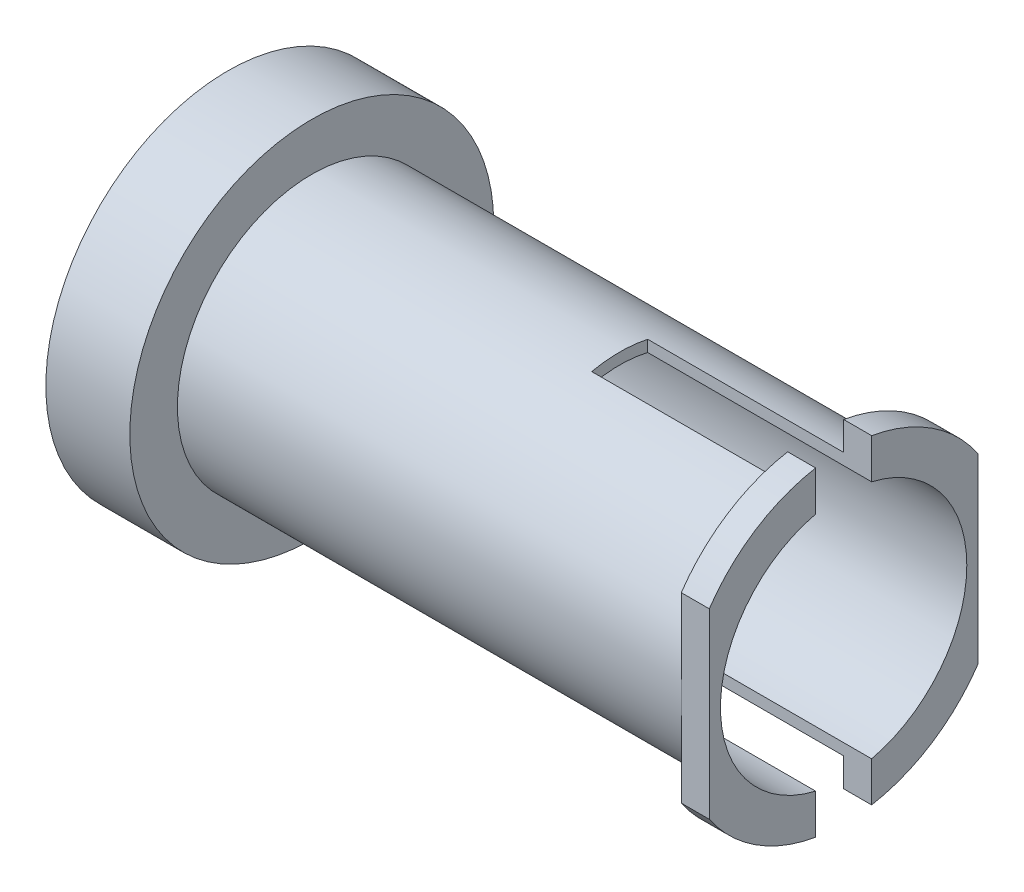
from build123d import *

# Parameters (mm, degrees)
CUT_EXTRUDE6_DEPTH = 4
SKETCH5_R          = 2.2
CUT_EXTRUDE7_DEPTH = 5.5


with BuildPart() as part:
    # Sketch3 → Revolve5 (revolve)
    with BuildSketch(Plane.XY, mode=Mode.PRIVATE) as revolve5_sk:
        Polygon((0, 0), (0, 3.25), (1.5, 3.25), (1.5, 2.4), (10.5, 2.4), (10.5, 2.9), (11, 2.9), (11, 0), align=None)
    revolve(revolve5_sk.sketch.rotate(Axis((11, 0, 0), (-1, 0, 0)), 90), axis=Axis((11, 0, 0), (-1, 0, 0)))

    # Sketch4 → Cut-Extrude6 (cut)
    with BuildSketch(Plane(origin=(11, 0, 0), x_dir=(0, 0, -1), z_dir=(1, 0, 0))):
        with BuildLine():
            ThreePointArc((-0.5, -2.856571371), (-0.250941252, -2.889122443), (-3e-09, -2.9))
            ThreePointArc((-3e-09, -2.9), (0.25094125, -2.889122443), (0.5, -2.856571371))
            Line((0.5, -2.856571371), (0.5, -2.142428529))
            ThreePointArc((0.5, -2.142428529), (0, -2.2), (-0.5, -2.142428529))
            Line((-0.5, -2.142428529), (-0.5, -2.856571371))
        make_face()
        with BuildLine():
            Line((-0.5, 2.856571371), (-0.5, 2.142428529))
            ThreePointArc((-0.5, 2.142428529), (0, 2.2), (0.5, 2.142428529))
            Line((0.5, 2.142428529), (0.5, 2.856571371))
            ThreePointArc((0.5, 2.856571371), (0.250941244, 2.889122443), (-1.4e-08, 2.9))
            ThreePointArc((-1.4e-08, 2.9), (-0.250941258, 2.889122442), (-0.5, 2.856571371))
        make_face()
        with BuildLine():
            Line((-0.5, 2.142428529), (-0.5, -2.142428529))
            ThreePointArc((-0.5, -2.142428529), (0, -2.2), (0.5, -2.142428529))
            Line((0.5, -2.142428529), (0.5, 2.142428529))
            ThreePointArc((0.5, 2.142428529), (0, 2.2), (-0.5, 2.142428529))
        make_face()
        with BuildLine():
            ThreePointArc((-0.5, 2.142428529), (-2.2, 0), (-0.5, -2.142428529))
            Line((-0.5, -2.142428529), (-0.5, 2.142428529))
        make_face()
        with BuildLine():
            Line((0.5, 2.142428529), (0.5, -2.142428529))
            ThreePointArc((0.5, -2.142428529), (1.723368794, -1.367479433), (2.2, 0))
            ThreePointArc((2.2, 0), (1.723368794, 1.367479433), (0.5, 2.142428529))
        make_face()
        with BuildLine():
            Line((2.4, 1.62788206), (2.4, -1.62788206))
            ThreePointArc((2.4, -1.62788206), (2.772183255, -0.851469318), (2.9, 0))
            ThreePointArc((2.9, 0), (2.772183255, 0.851469318), (2.4, 1.62788206))
        make_face()
        with BuildLine():
            ThreePointArc((-2.9, -6e-09), (-2.772183254, -0.851469321), (-2.4, -1.62788206))
            Line((-2.4, -1.62788206), (-2.4, 1.62788206))
            ThreePointArc((-2.4, 1.62788206), (-2.772183256, 0.851469315), (-2.9, -6e-09))
        make_face()
    extrude(amount=-CUT_EXTRUDE6_DEPTH, mode=Mode.SUBTRACT)

    # Sketch5 → Cut-Extrude7 (cut)
    with BuildSketch(Plane(origin=(7, 0, 0), x_dir=(0, 0, -1), z_dir=(1, 0, 0))):
        Circle(SKETCH5_R)
    extrude(amount=-CUT_EXTRUDE7_DEPTH, mode=Mode.SUBTRACT)


solid = part.part
